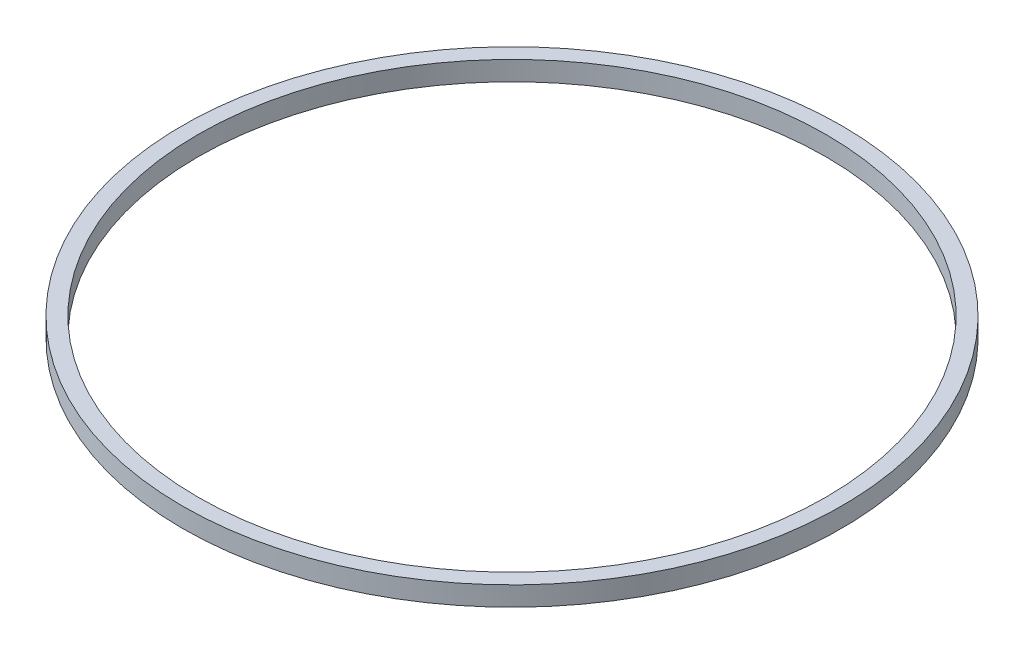
from build123d import *

# Parameters (mm, degrees)
SKETCH1_R           = 85
SKETCH1_R_2         = 81
BOSS_EXTRUDE1_DEPTH = 5


with BuildPart() as part:
    # Sketch1 → Boss-Extrude1 (new body)
    with BuildSketch(Plane(origin=(0, 0, 0), x_dir=(1, 0, 0), z_dir=(0, 1, 0))):
        with Locations(Location((0, 0, 0), (0, 0, 270))):
            Circle(SKETCH1_R)
        with Locations(Location((0, 0, 0), (0, 0, 270))):
            Circle(SKETCH1_R_2, mode=Mode.SUBTRACT)
    extrude(amount=BOSS_EXTRUDE1_DEPTH)


solid = part.part
